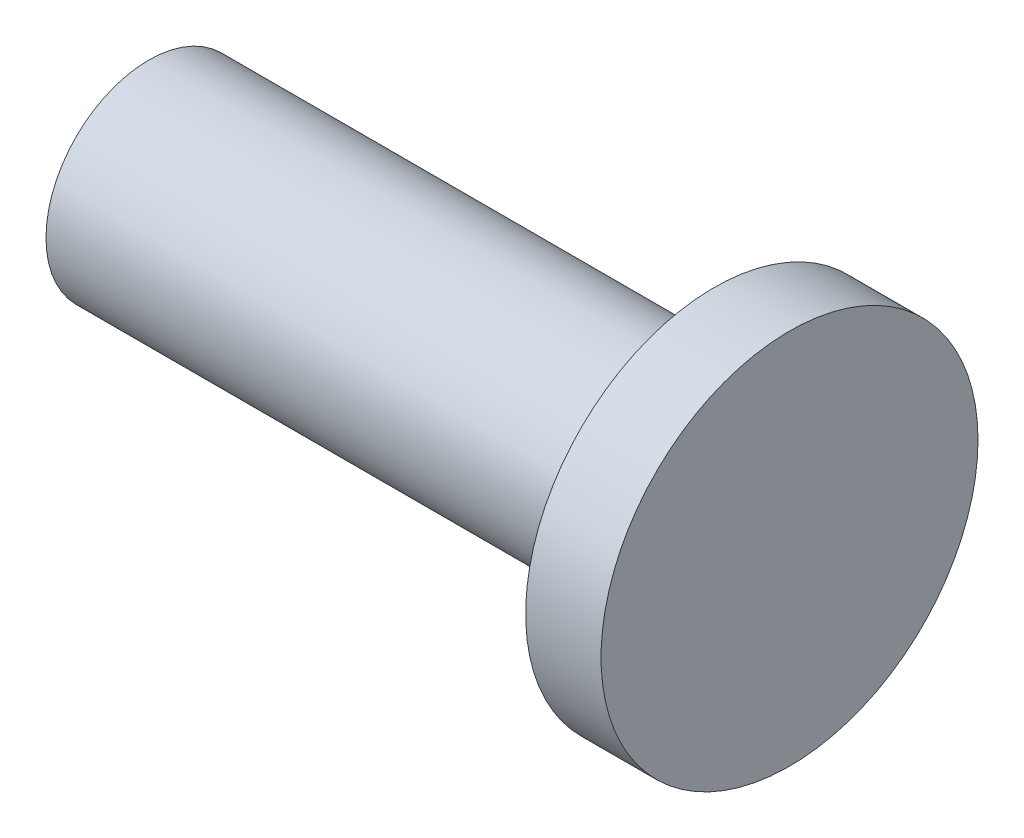
from build123d import *

# Parameters (mm, degrees)
SKETCH1_R           = 2.725
BOSS_EXTRUDE1_DEPTH = 15
SKETCH2_R           = 5
BOSS_EXTRUDE2_DEPTH = 2


with BuildPart() as part:
    # Sketch1 → Boss-Extrude1 (new body)
    with BuildSketch(Plane(origin=(0, 0, 0), x_dir=(0, 0, -1), z_dir=(1, 0, 0))):
        Circle(SKETCH1_R)
    extrude(amount=BOSS_EXTRUDE1_DEPTH)

    # Sketch2 → Boss-Extrude2 (add)
    with BuildSketch(Plane(origin=(15, 0, 0), x_dir=(0, 0, -1), z_dir=(1, 0, 0))):
        Circle(SKETCH2_R)
    extrude(amount=BOSS_EXTRUDE2_DEPTH)


solid = part.part
